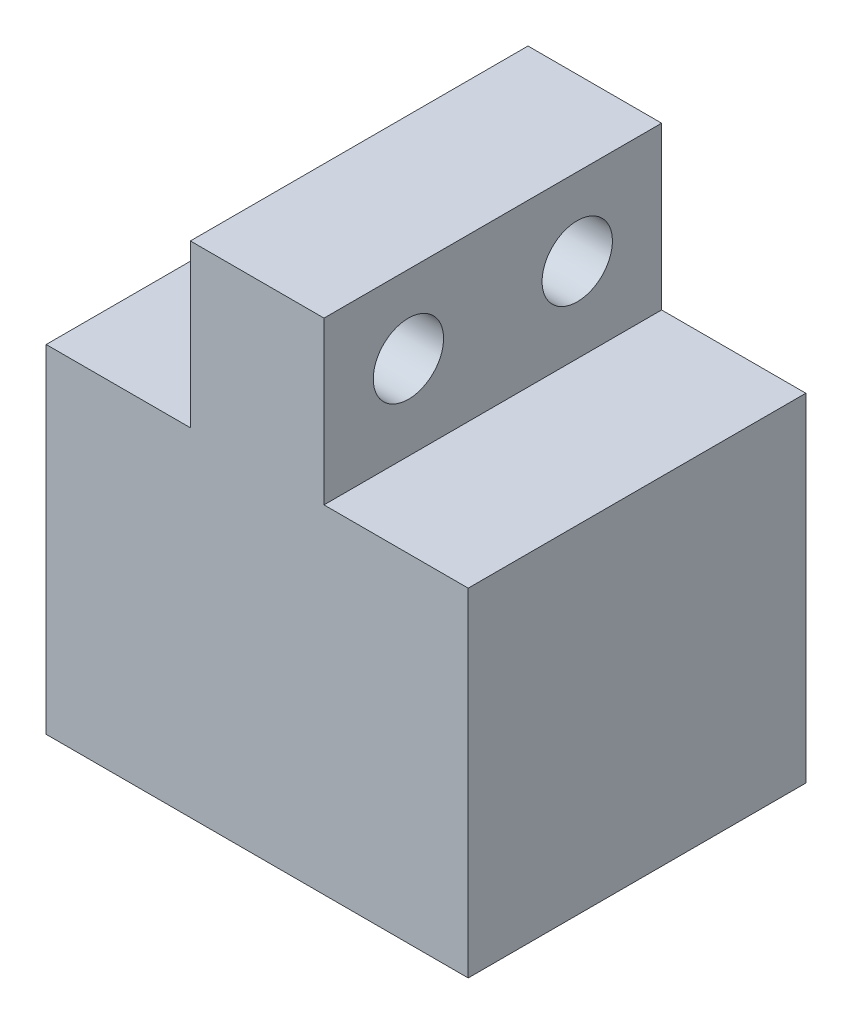
from build123d import *

# Parameters (mm, degrees)
SKETCH1_W           = 4.75
SKETCH1_H           = 5.75
SKETCH1_W_2         = 15
SKETCH1_H_2         = 12
BOSS_EXTRUDE1_DEPTH = 12
SKETCH2_R           = 1.25
CUT_EXTRUDE1_DEPTH  = 10


with BuildPart() as part:
    # Sketch1 → Boss-Extrude1 (new body)
    with BuildSketch(Plane.XY):
        with Locations((7.5, 14.875)):
            Rectangle(SKETCH1_W, SKETCH1_H)
        with Locations((7.5, 6)):
            Rectangle(SKETCH1_W_2, SKETCH1_H_2)
    extrude(amount=BOSS_EXTRUDE1_DEPTH)

    # Sketch2 → Cut-Extrude1 (cut)
    with BuildSketch(Plane.ZY.offset(-5.125)):
        with Locations((3, 15)):
            Circle(SKETCH2_R)
        with Locations((9, 15)):
            Circle(SKETCH2_R)
    extrude(amount=-CUT_EXTRUDE1_DEPTH, mode=Mode.SUBTRACT)


solid = part.part
